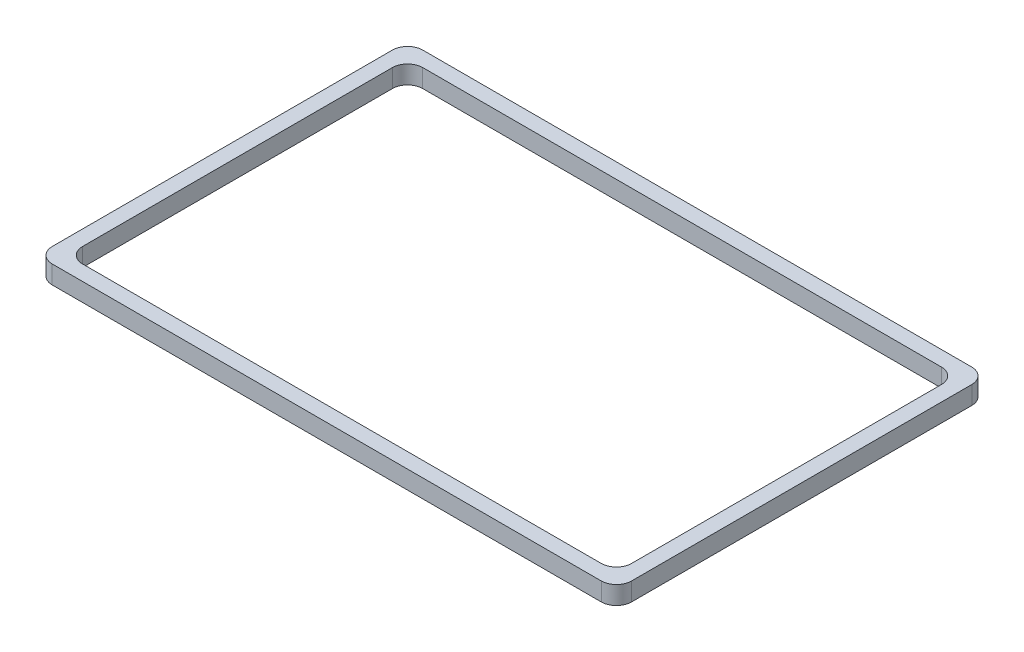
from build123d import *

# Parameters (mm, degrees)
EXTRUDE_1_DEPTH = 12


with BuildPart() as part:
    # 草图1 → 凸台-拉伸1 (new body)
    with BuildSketch(Plane(origin=(0, 0, 0), x_dir=(1, 0, 0), z_dir=(0, 1, 0))):
        with BuildLine():
            Line((-181, 122.15), (181, 122.15))
            ThreePointArc((181, 122.15), (188.071067812, 119.221067812), (191, 112.15))
            Line((191, 112.15), (191, -112.15))
            ThreePointArc((191, -112.15), (188.071067812, -119.221067812), (181, -122.15))
            Line((181, -122.15), (-181, -122.15))
            ThreePointArc((-181, -122.15), (-188.071067812, -119.221067812), (-191, -112.15))
            Line((-191, -112.15), (-191, 112.15))
            ThreePointArc((-191, 112.15), (-188.071067812, 119.221067812), (-181, 122.15))
        make_face()
        with BuildLine():
            Line((-171, 112.15), (171, 112.15))
            ThreePointArc((171, 112.15), (178.071067812, 109.221067812), (181, 102.15))
            Line((181, 102.15), (181, -102.15))
            ThreePointArc((181, -102.15), (178.071067812, -109.221067812), (171, -112.15))
            Line((171, -112.15), (-171, -112.15))
            ThreePointArc((-171, -112.15), (-178.071067812, -109.221067812), (-181, -102.15))
            Line((-181, -102.15), (-181, 102.15))
            ThreePointArc((-181, 102.15), (-178.071067812, 109.221067812), (-171, 112.15))
        make_face(mode=Mode.SUBTRACT)
    extrude(amount=EXTRUDE_1_DEPTH)


solid = part.part
